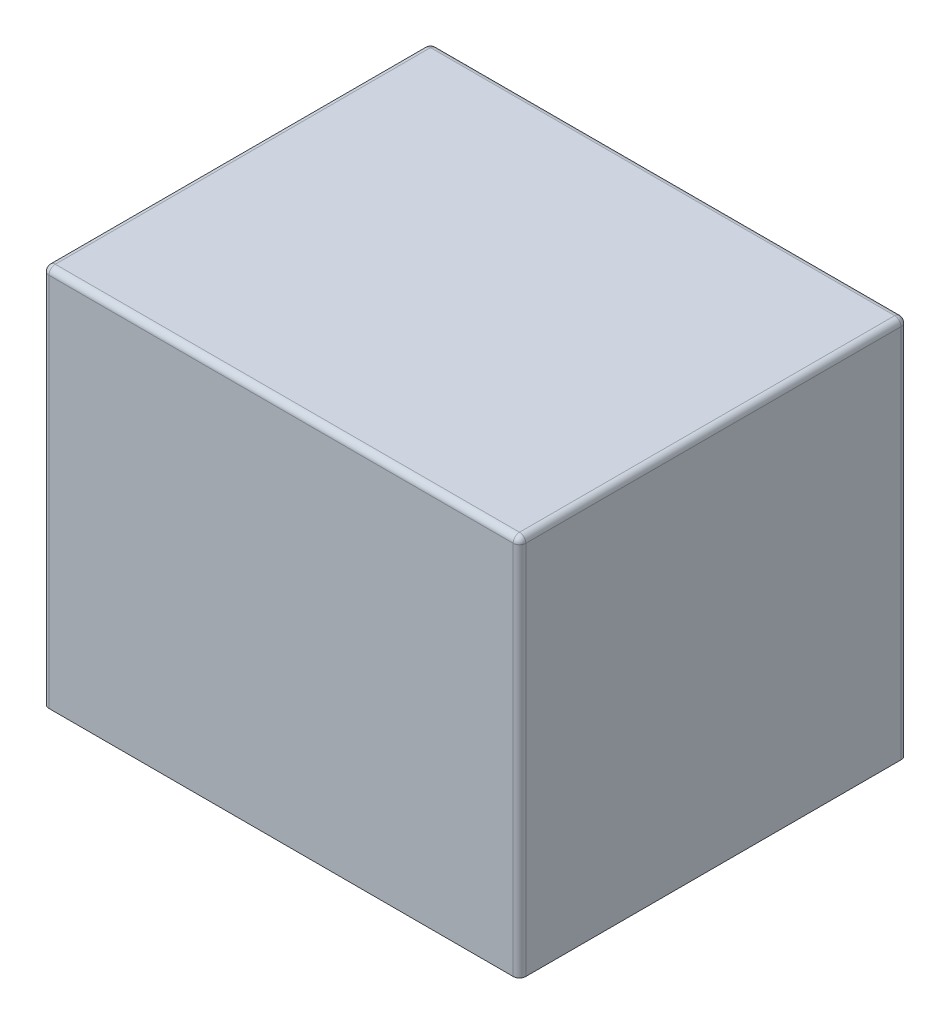
from build123d import *

# Parameters (mm, degrees)
SKETCH_1_W      = 19.05
SKETCH_1_H      = 15.24
EXTRUDE_1_DEPTH = 15.494
FILLET_1_R      = 0.254


with BuildPart() as part:
    # 草图1 → 凸台-拉伸1 (new body)
    with BuildSketch(Plane.XY):
        with Locations((9.525, 7.62)):
            Rectangle(SKETCH_1_W, SKETCH_1_H)
    extrude(amount=-EXTRUDE_1_DEPTH)

    # 圆角1
    fillet_1_edges = [part.edges().sort_by_distance(p)[0] for p in [
        (19.05, 7.62, -15.494),
        (9.525, 15.24, -15.494),
        (0, 7.62, -15.494),
        (9.525, 15.24, 0),
        (19.05, 7.62, 0),
        (0, 7.62, 0),
        (0, 15.24, -7.747),
        (19.05, 15.24, -7.747),
    ]]
    fillet(fillet_1_edges, radius=FILLET_1_R)


solid = part.part
